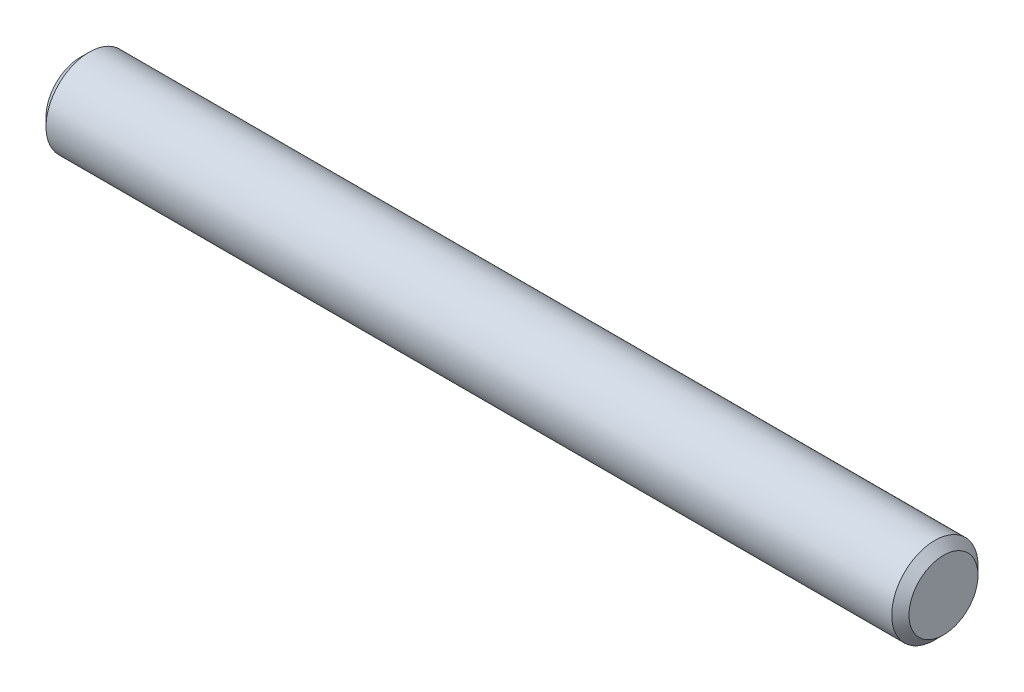
from build123d import *

# Parameters (mm, degrees)
EXTRUDE1_DEPTH      = 31.75
EXTRUDE1_DEPTH_BACK = 31.75
SKETCH2_R           = 3.175
CHAMFER1_SIZE       = 0.635


with BuildPart() as part:
    # Sketch2 → Extrude1 (new, two sides: drawn at the far end of the back side and taken through both)
    with BuildSketch(Plane(origin=(0, 0, 0), x_dir=(0, 0, -1), z_dir=(1, 0, 0)).offset(-EXTRUDE1_DEPTH_BACK)):
        Circle(SKETCH2_R)
    extrude(amount=EXTRUDE1_DEPTH + EXTRUDE1_DEPTH_BACK)

    # Chamfer1
    chamfer1_edges = [part.edges().sort_by_distance(p)[0] for p in [
        (-31.75, 0, 3.175),
        (31.75, 0, 3.175),
    ]]
    chamfer(chamfer1_edges, length=CHAMFER1_SIZE)


solid = part.part
